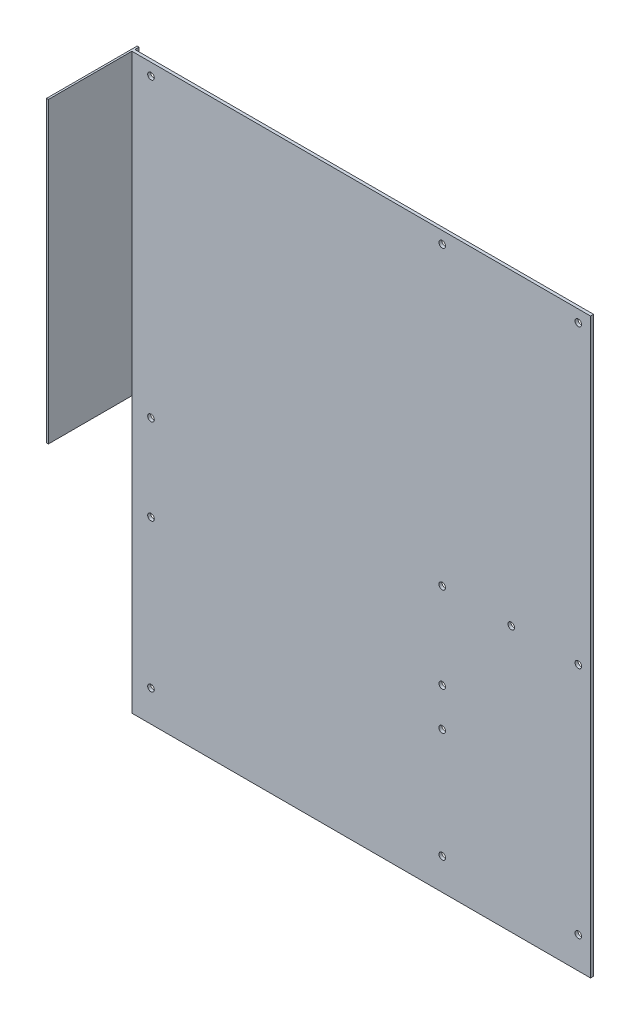
from build123d import *

# Parameters (mm, degrees)
SKETCH_1_W           = 244
SKETCH_1_H           = 305
EXTRUDE_1_DEPTH      = 1.6
SKETCH_2_R           = 1.75
CUT_EXTRUDE_1_DEPTH  = 391.593855558
EXTRUDE_2_DEPTH      = 44.45
EXTRUDE_2_DEPTH_BACK = 3.81
SKETCH_3_W           = 1
SKETCH_3_H           = 158.75


with BuildPart() as part:
    # 草图1 → 凸台-拉伸1 (new body)
    with BuildSketch(Plane.XY):
        with Locations((122, 152.5)):
            Rectangle(SKETCH_1_W, SKETCH_1_H)
    extrude(amount=EXTRUDE_1_DEPTH)

    # 草图2 → 切除-拉伸1 (cut, through all)
    with BuildSketch(Plane.XY.offset(1.6)):
        with Locations((10.16, 16.69)):
            Circle(SKETCH_2_R)
        with Locations((165.1, 16.69)):
            Circle(SKETCH_2_R)
        with Locations((237.49, 16.69)):
            Circle(SKETCH_2_R)
        with Locations((165.1, 75.11)):
            Circle(SKETCH_2_R)
        with Locations((10.16, 95.43)):
            Circle(SKETCH_2_R)
        with Locations((165.1, 95.43)):
            Circle(SKETCH_2_R)
        with Locations((10.16, 141.15)):
            Circle(SKETCH_2_R)
        with Locations((165.1, 141.15)):
            Circle(SKETCH_2_R)
        with Locations((237.49, 141.15)):
            Circle(SKETCH_2_R)
        with Locations((10.16, 298.63)):
            Circle(SKETCH_2_R)
        with Locations((165.1, 298.63)):
            Circle(SKETCH_2_R)
        with Locations((237.49, 298.63)):
            Circle(SKETCH_2_R)
        with Locations((201.816, 141.15)):
            Circle(SKETCH_2_R)
    extrude(amount=-CUT_EXTRUDE_1_DEPTH, mode=Mode.SUBTRACT)

    # 草图3 → 凸台-拉伸2 (add, two sides: drawn at the far end of the back side and taken through both)
    with BuildSketch(Plane.XY.offset(1.6).offset(-EXTRUDE_2_DEPTH_BACK)):
        with Locations((-0.5, 225.625)):
            Rectangle(SKETCH_3_W, SKETCH_3_H)
    extrude(amount=EXTRUDE_2_DEPTH + EXTRUDE_2_DEPTH_BACK)


solid = part.part
